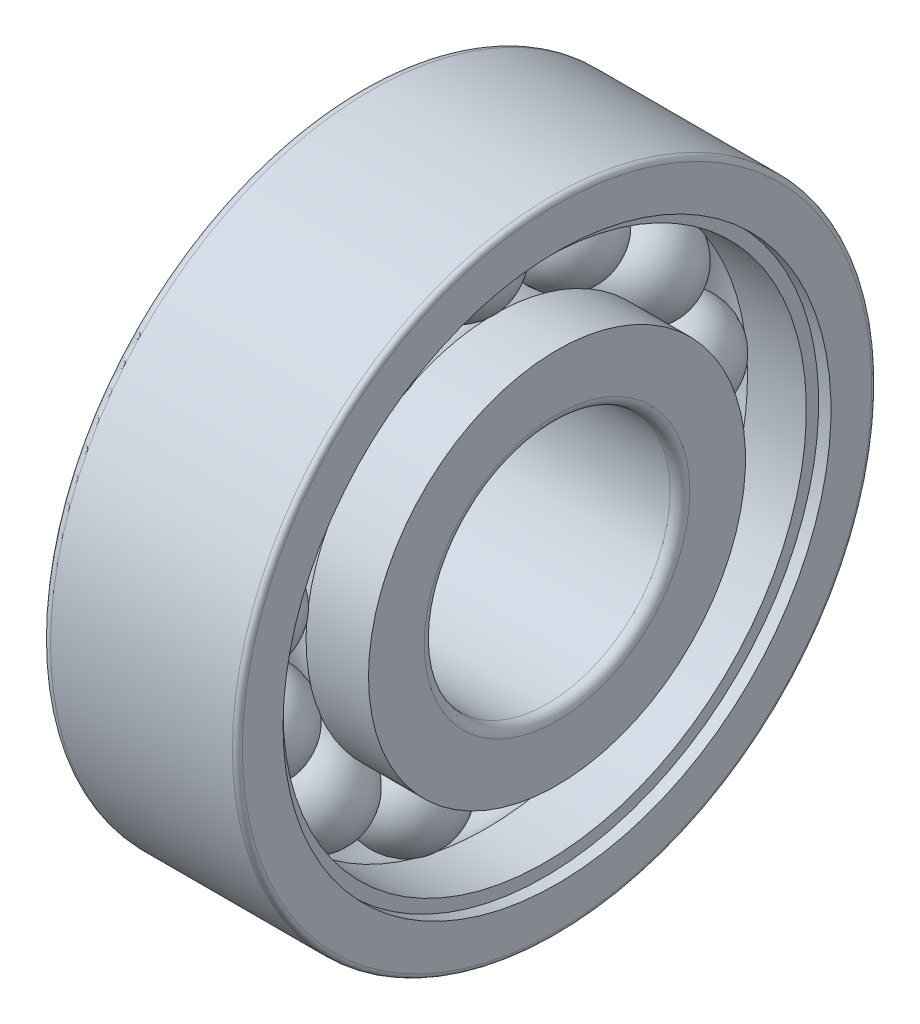
from build123d import *

# Parameters (mm, degrees)
CIRCULAR_PATTERN1_COUNT = 13
FILLET1_R               = 0.2
FILLET2_R               = 0.1


with BuildPart() as part:
    # Sketch1 → Revolve1 (revolve)
    with BuildSketch(Plane.XY):
        with BuildLine():
            Line((-1, 4.5), (1, 4.5))
            ThreePointArc((1, 4.5), (0, 3.5), (-1, 4.5))
        make_face()
    revolve1 = revolve(axis=Axis((-3.091912561, 4.5, 0), (1, 0, 0)))

    # Sketch2 → Revolve2 (revolve)
    with BuildSketch(Plane.XY, mode=Mode.PRIVATE) as revolve2_sk:
        with BuildLine():
            Line((-2, 3.833333333), (-0.731884933, 3.833333333))
            ThreePointArc((-0.731884933, 3.833333333), (0, 3.51), (0.731884933, 3.833333333))
            Line((0.731884933, 3.833333333), (2, 3.833333333))
            Line((2, 3.833333333), (2, 2.5))
            Line((2, 2.5), (-2, 2.5))
            Line((-2, 2.5), (-2, 3.833333333))
        make_face()
    revolve(revolve2_sk.sketch.rotate(Axis((-2.992358943, 0, 0), (1, 0, 0)), 90), axis=Axis((-2.992358943, 0, 0), (1, 0, 0)))

    # Sketch3 → Revolve3 (revolve)
    with BuildSketch(Plane.XY, mode=Mode.PRIVATE) as revolve3_sk:
        with BuildLine():
            Line((-2, 5.166666667), (-2, 6.5))
            Line((-2, 6.5), (2, 6.5))
            Line((2, 6.5), (2, 5.571666667))
            Line((2, 5.571666667), (1.75, 5.571666667))
            Line((1.75, 5.571666667), (1.75, 5.321666667))
            Line((1.75, 5.321666667), (0.552235356, 5.321666667))
            ThreePointArc((0.552235356, 5.321666667), (-0.11863702, 5.482865839), (-0.731884933, 5.166666667))
            Line((-0.731884933, 5.166666667), (-2, 5.166666667))
        make_face()
    revolve(revolve3_sk.sketch.rotate(Axis((-2.992358943, 0, 0), (1, 0, 0)), 90), axis=Axis((-2.992358943, 0, 0), (1, 0, 0)))

    # Circular-Pattern1: Revolve1 ×13 about axis
    circular_pattern1_axis = Axis((0, 0, 0), (1, 0, 0))
    for i in range(1, CIRCULAR_PATTERN1_COUNT):
        add(revolve1.rotate(circular_pattern1_axis, i * 360 / CIRCULAR_PATTERN1_COUNT))

    # Fillet1
    fillet1_edges = [part.edges().sort_by_distance(p)[0] for p in [
        (-2, 0, -6.5),
        (2, 0, -2.5),
    ]]
    fillet(fillet1_edges, radius=FILLET1_R)

    # Fillet2
    fillet2_edges = [part.edges().sort_by_distance(p)[0] for p in [
        (2, 0, -6.5),
        (-2, 0, -2.5),
    ]]
    fillet(fillet2_edges, radius=FILLET2_R)


solid = part.part
